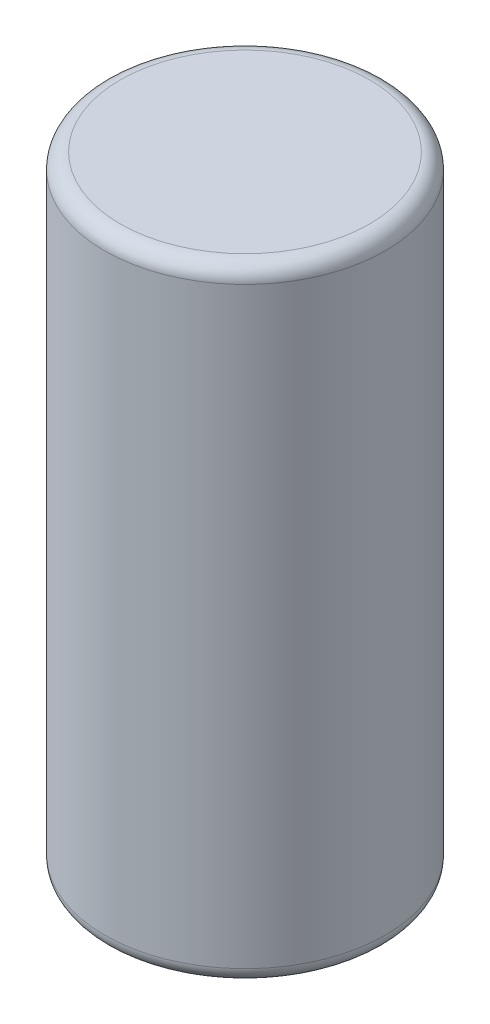
from build123d import *

# Parameters (mm, degrees)
SKETCH2_R           = 9
BOSS_EXTRUDE1_DEPTH = 40
CUT_EXTRUDE1_DEPTH  = 10
FILLET1_R           = 1
FILLET2_R           = 1


with BuildPart() as part:
    # Sketch2 → Boss-Extrude1 (new body)
    with BuildSketch(Plane(origin=(0, 0, 0), x_dir=(1, 0, 0), z_dir=(0, 1, 0))):
        with Locations(Location((0, 0, 0), (0, 0, 270))):
            Circle(SKETCH2_R)
    extrude(amount=BOSS_EXTRUDE1_DEPTH)

    # Sketch4 → Cut-Extrude1 (cut)
    with BuildSketch(Plane.XZ):
        with BuildLine():
            Line((-2.867677405, 0.881150554), (2.867677405, 0.881150554))
            ThreePointArc((2.867677405, 0.881150554), (0, -3), (-2.867677405, 0.881150554))
        make_face()
    extrude(amount=-CUT_EXTRUDE1_DEPTH, mode=Mode.SUBTRACT)

    # Fillet1
    fillet1_edges = [part.edges().sort_by_distance(p)[0] for p in [
        (0, 0, -9),
    ]]
    fillet(fillet1_edges, radius=FILLET1_R)

    # Fillet2
    fillet2_edges = [part.edges().sort_by_distance(p)[0] for p in [
        (0, 40, -9),
    ]]
    fillet(fillet2_edges, radius=FILLET2_R)


solid = part.part
